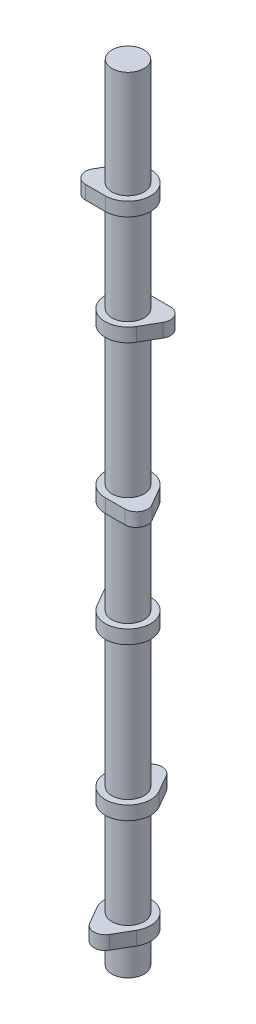
from build123d import *

# Parameters (mm, degrees)
BOSS_EXTRUDE5_DEPTH   = 7.62
BODY_MOVE_COPY3_ANGLE = 180
BOSS_EXTRUDE7_START   = -25.4
SKETCH7_R             = 9
BOSS_EXTRUDE7_DEPTH   = 146.05
LPATTERN1_COUNT       = 3
LPATTERN1_PITCH       = 146.05
BODY_MOVE_COPY4_ANGLE = 120
BODY_MOVE_COPY5_ANGLE = 120


with BuildPart() as part:
    # Sketch6 → Boss-Extrude5 (new body)
    with BuildSketch(Plane(origin=(0, 0, 0), x_dir=(-1, 0, 0), z_dir=(0, 1, 0))):
        with BuildLine():
            Line((-5.499261314, 15.875), (-10.998522628, 6.35))
            ThreePointArc((-10.998522628, 6.35), (0, -12.7), (10.998522628, 6.35))
            Line((10.998522628, 6.35), (5.499261314, 15.875))
            ThreePointArc((5.499261314, 15.875), (0, 19.05), (-5.499261314, 15.875))
        make_face()
    extrude(amount=BOSS_EXTRUDE5_DEPTH)


with BuildPart() as body_2:
    # Body-Move/Copy2: copy of part
    add(part.part.moved(Location((0, 60.9, 0))))


with BuildPart() as body_2_1:
    # Body-Move/Copy3: moved
    add(body_2.part.rotate(Axis((0, 0, 0), (0, 1, 0)), BODY_MOVE_COPY3_ANGLE))


with BuildPart() as part_1:
    add(part.part)

    add(body_2_1.part)  # Boss-Extrude7 merges body 2
    # Sketch7 → Boss-Extrude7 (add)
    with BuildSketch(Plane(origin=(0, 7.62, 0), x_dir=(-1, 0, 0), z_dir=(0, 1, 0)).offset(BOSS_EXTRUDE7_START)):
        Circle(SKETCH7_R)
    extrude(amount=BOSS_EXTRUDE7_DEPTH)


with BuildPart() as lpattern1_1:
    # LPattern1: pattern copy
    add(part_1.part.moved(Location(Vector(0, 1, 0) * (1 * LPATTERN1_PITCH))))


with BuildPart() as lpattern1_2:
    # LPattern1: pattern copy
    add(part_1.part.moved(Location(Vector(0, 1, 0) * (2 * LPATTERN1_PITCH))))


with BuildPart() as lpattern1_1_1:
    # Body-Move/Copy4: moved
    add(lpattern1_1.part.rotate(Axis((0, 0, 0), (0, -1, 0)), BODY_MOVE_COPY4_ANGLE))


with BuildPart() as lpattern1_2_1:
    # Body-Move/Copy5: moved
    add(lpattern1_2.part.rotate(Axis((0, 0, 0), (0, 1, 0)), BODY_MOVE_COPY5_ANGLE))

    # Combine1: union part, LPattern1_1
    add(part_1.part)
    add(lpattern1_1_1.part)


solid = lpattern1_2_1.part
